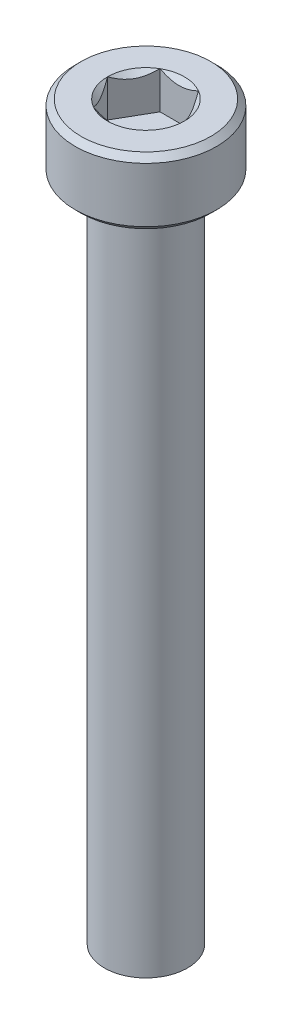
from build123d import *

# Parameters (mm, degrees)
SKETCH1_R           = 4.25
BOSS_EXTRUDE1_DEPTH = 4
CUT_EXTRUDE1_DEPTH  = 2.25
CHAMFER1_SIZE       = 0.35
SKETCH_1_R          = 2.5
EXTRUDE_1_DEPTH     = 40


with BuildPart() as part:
    # Sketch1 → Boss-Extrude1 (new body)
    with BuildSketch(Plane(origin=(0, 0, 0), x_dir=(1, 0, 0), z_dir=(0, 1, 0))):
        with Locations(Location((0, 0, 0), (0, 0, 270))):
            Circle(SKETCH1_R)
    extrude(amount=BOSS_EXTRUDE1_DEPTH)

    # Sketch2 → Cut-Extrude1 (cut)
    with BuildSketch(Plane(origin=(0, 4, 0), x_dir=(1, 0, 0), z_dir=(0, 1, 0))):
        Polygon((1.154700538, 2), (-1.154700538, 2), (-2.309401077, 0), (-1.154700538, -2), (1.154700538, -2), (2.309401077, 0), align=None)
    extrude(amount=-CUT_EXTRUDE1_DEPTH, mode=Mode.SUBTRACT)

    # Cut-Extrude2 cone 1 section (through the dimple's axis) → Cut-Extrude2 (revolve, cut)
    with BuildSketch(Plane(origin=(0, 4, 0), x_dir=(0, 0, 1), z_dir=(1, 0, 0))):
        Polygon((0, 0), (2.309401077, 0), (0, 2.309401077), align=None)
    revolve(axis=Axis((0, 4, 0), (0, -1, 0)), mode=Mode.SUBTRACT)

    # Chamfer1
    chamfer1_edges = [part.edges().sort_by_distance(p)[0] for p in [
        (0, 0, -4.25),
        (0, 4, -4.25),
    ]]
    chamfer(chamfer1_edges, length=CHAMFER1_SIZE)

    # 草图1 → 凸台-拉伸1 (add)
    with BuildSketch(Plane(origin=(0, 0, 0), x_dir=(-1, 0, 0), z_dir=(0, -1, 0))):
        with Locations(Location((0, 0, 0), (0, 0, 90))):
            Circle(SKETCH_1_R)
    extrude(amount=EXTRUDE_1_DEPTH)


solid = part.part
